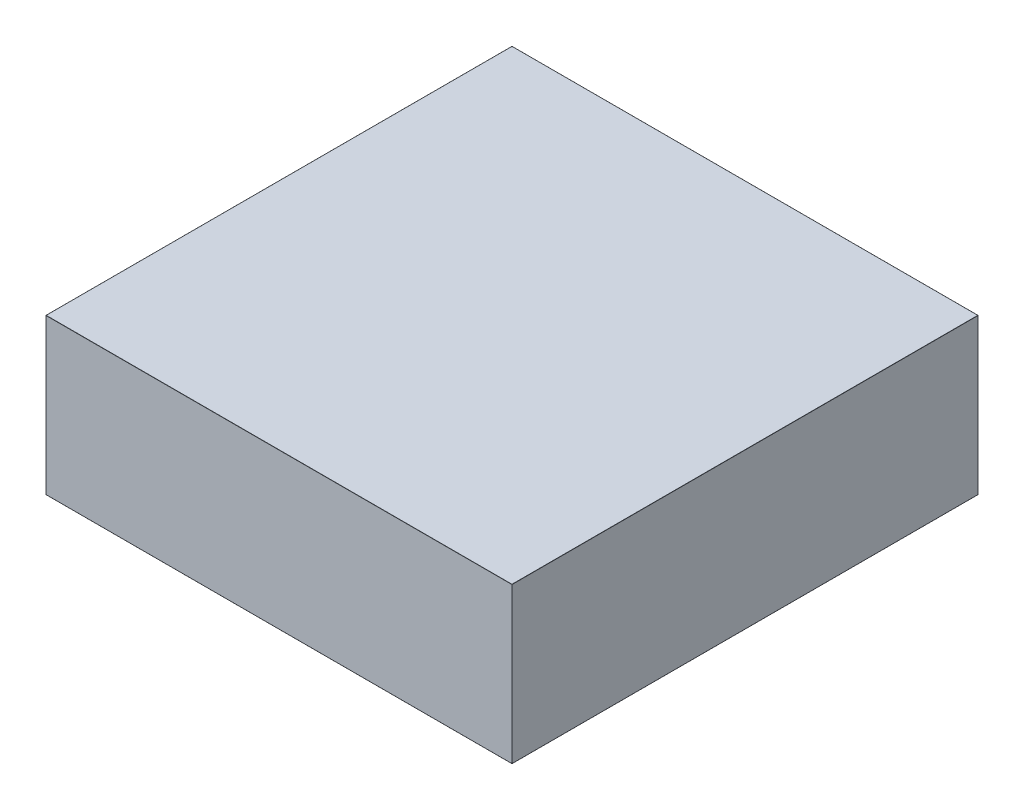
from build123d import *

# Parameters (mm, degrees)
SKETCH1_W           = 300
SKETCH1_H           = 100
BOSS_EXTRUDE1_DEPTH = 150
FILLET1_R           = 0.1


with BuildPart() as part:
    # Sketch1 → Boss-Extrude1 (new, symmetric)
    with BuildSketch(Plane.XY):
        Rectangle(SKETCH1_W, SKETCH1_H)
    extrude(amount=BOSS_EXTRUDE1_DEPTH, both=True)

    # Fillet1
    fillet1_edges = [part.edges().sort_by_distance(p)[0] for p in [
        (-150, 0, 150),
        (0, -50, 150),
        (150, 0, 150),
        (0, -50, -150),
        (-150, 0, -150),
        (0, 50, -150),
        (150, 0, -150),
        (150, -50, 0),
        (-150, -50, 0),
        (-150, 50, 0),
        (150, 50, 0),
        (0, 50, 150),
    ]]
    fillet(fillet1_edges, radius=FILLET1_R)


solid = part.part
